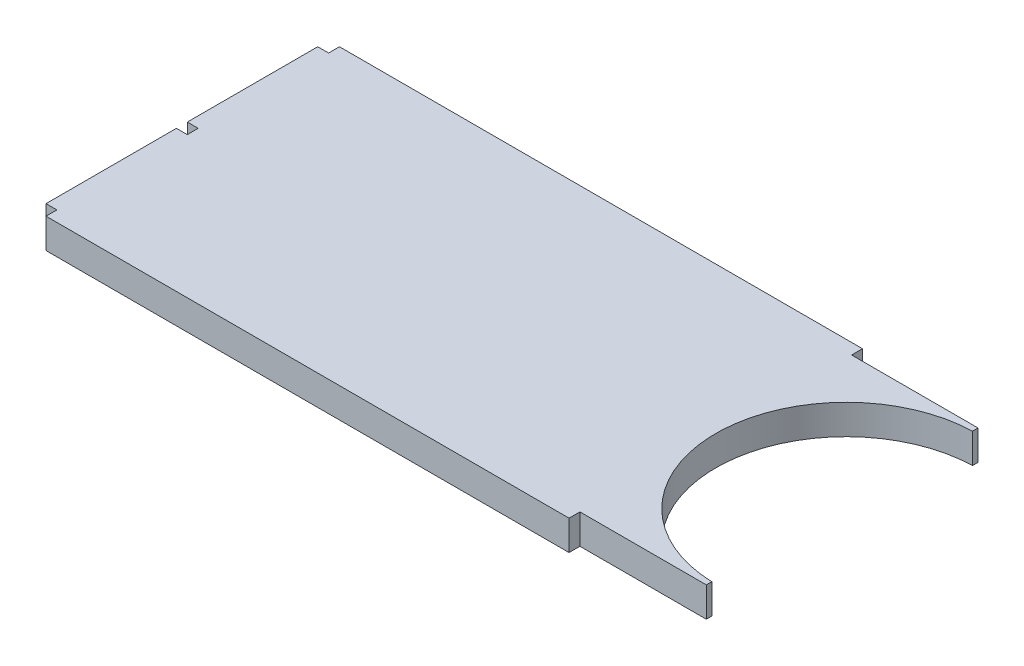
from build123d import *

# Parameters (mm, degrees)
SKETCH1_W           = 121.5
SKETCH1_H           = 54
BOSS_EXTRUDE1_DEPTH = 5.4864
SKETCH2_W           = 2
SKETCH2_H           = 2
SKETCH2_W_2         = 23.254
CUT_EXTRUDE1_DEPTH  = 67.705794988


with BuildPart() as part:
    # Sketch1 → Boss-Extrude1 (new body)
    with BuildSketch(Plane(origin=(0, 0, 0), x_dir=(1, 0, 0), z_dir=(0, 1, 0))):
        Rectangle(SKETCH1_W, SKETCH1_H)
    extrude(amount=BOSS_EXTRUDE1_DEPTH)

    # Sketch2 → Cut-Extrude1 (cut, through all)
    with BuildSketch(Plane(origin=(0, 5.4864, 0), x_dir=(1, 0, 0), z_dir=(0, 1, 0))):
        with Locations((-59.75, 0)):
            Rectangle(SKETCH2_W, SKETCH2_H)
        with Locations((-59.75, 26)):
            Rectangle(SKETCH2_W, SKETCH2_H)
        with Locations((-59.75, -26)):
            Rectangle(SKETCH2_W, SKETCH2_H)
        with Locations((49.123, 26)):
            Rectangle(SKETCH2_W_2, SKETCH2_H)
        with Locations((49.123, -26)):
            Rectangle(SKETCH2_W_2, SKETCH2_H)
        with BuildLine():
            Line((60.75, 23.988403115), (60.75, -23.988403115))
            ThreePointArc((60.75, -23.988403115), (37.496, 0), (60.75, 23.988403115))
        make_face()
    extrude(amount=-CUT_EXTRUDE1_DEPTH, mode=Mode.SUBTRACT)


solid = part.part
